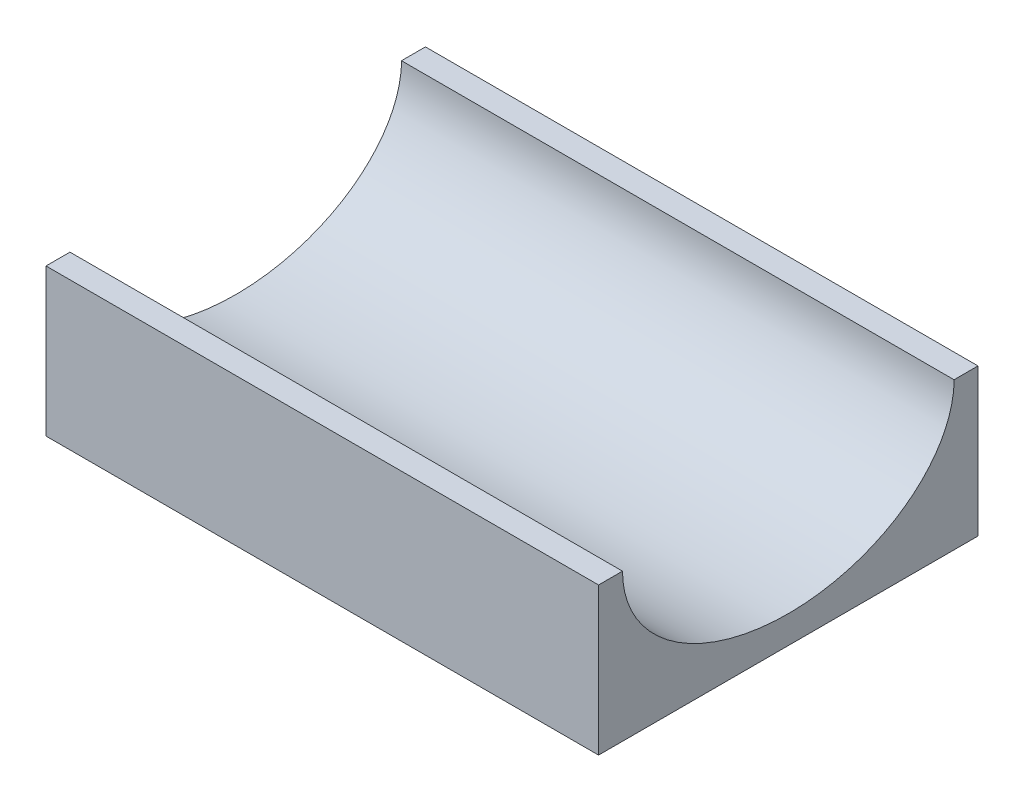
from build123d import *

# Parameters (mm, degrees)
SKETCH1_W           = 95.25
SKETCH1_H           = 65.405
BOSS_EXTRUDE1_DEPTH = 4.7625
BOSS_EXTRUDE3_DEPTH = 95.25


with BuildPart() as part:
    # Sketch1 → Boss-Extrude1 (new body)
    with BuildSketch(Plane(origin=(0, 0, 0), x_dir=(1, 0, 0), z_dir=(0, 1, 0))):
        with Locations((47.625, 32.7025)):
            Rectangle(SKETCH1_W, SKETCH1_H)
    extrude(amount=-BOSS_EXTRUDE1_DEPTH)

    # Sketch4 → Boss-Extrude3 (add)
    with BuildSketch(Plane(origin=(0, 0, 0), x_dir=(0, 0, -1), z_dir=(1, 0, 0))):
        with BuildLine():
            Line((0, 20.6375), (0, 0))
            Line((0, 0), (32.7025, 0))
            add(Edge.make_bspline(
                [(4.1275, 20.6375), (4.1275, 0), (32.7025, 0)],
                knots=[0, 0, 0, 1.570796327, 1.570796327, 1.570796327], degree=2, weights=[1, 0.707106781, 1]))
            Line((4.1275, 20.6375), (0, 20.6375))
        make_face()
        with BuildLine():
            add(Edge.make_bspline(
                [(32.7025, 0), (61.2775, 0), (61.2775, 20.6375)],
                knots=[1.570796327, 1.570796327, 1.570796327, 3.141592654, 3.141592654, 3.141592654], degree=2, weights=[1, 0.707106781, 1]))
            Line((32.7025, 0), (65.405, 0))
            Line((65.405, 0), (65.405, 20.6375))
            Line((65.405, 20.6375), (61.2775, 20.6375))
        make_face()
    extrude(amount=BOSS_EXTRUDE3_DEPTH)


solid = part.part
